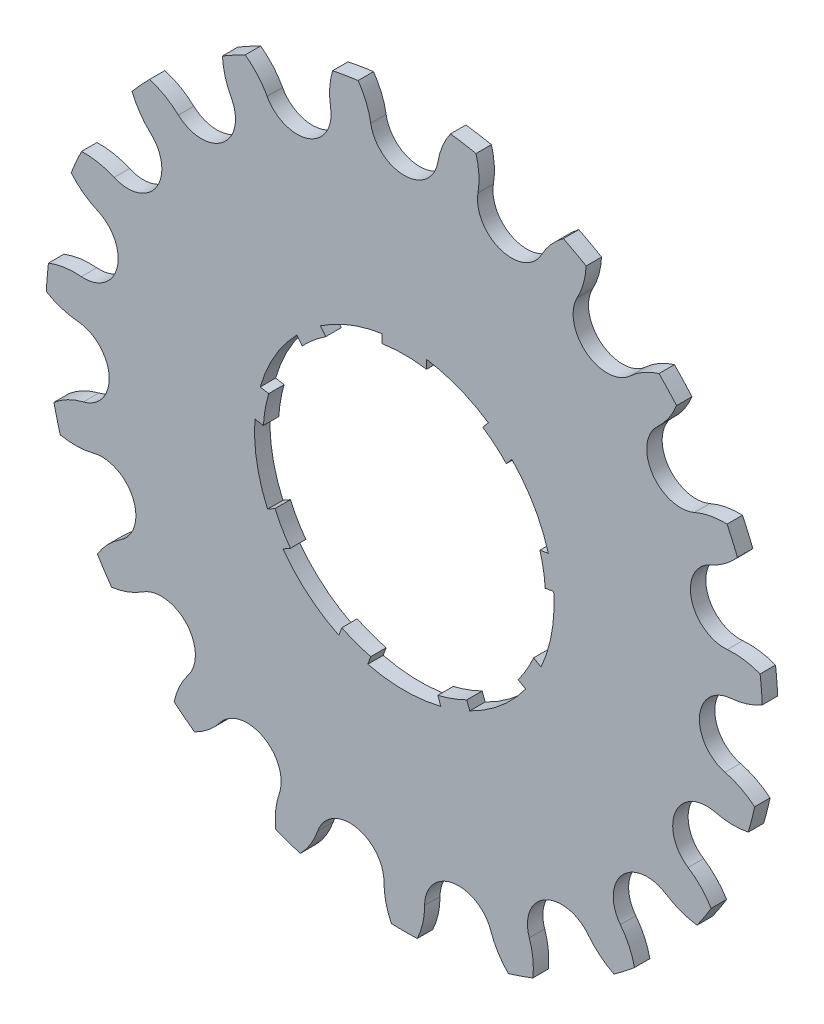
from build123d import *

# Parameters (mm, degrees)
SK_DISCO_R           = 41.863463762
DISCO_DEPTH          = 1.8
HUECO_DIENTE_DEPTH   = 60.231234971
MATRIZ_DIENTES_COUNT = 19


with BuildPart() as part:
    # Sk_Disco → Disco (new body)
    with BuildSketch(Plane.XY):
        Circle(SK_DISCO_R)
        with BuildLine():
            Line((2.6, 17.305779381), (2.6, 16.293863876))
            ThreePointArc((2.6, 16.293863876), (0, 16.5), (-2.6, 16.293863876))
            Line((-2.6, 16.293863876), (-2.6, 17.305779381))
            ThreePointArc((-2.6, 17.305779381), (-6.362648192, 16.302352836), (-9.810241185, 14.491693065))
            Line((-9.810241185, 14.491693065), (-9.163816615, 13.721314261))
            ThreePointArc((-9.163816615, 13.721314261), (-10.60599556, 12.639733311), (-11.92157661, 11.407278866))
            Line((-11.92157661, 11.407278866), (-12.56800118, 12.17765767))
            ThreePointArc((-12.56800118, 12.17765767), (-15.155444566, 8.75), (-16.830161491, 4.795379462))
            Line((-16.830161491, 4.795379462), (-15.839781591, 4.620748764))
            ThreePointArc((-15.839781591, 4.620748764), (-16.249327925, 2.865194932), (-16.464915031, 1.075440854))
            Line((-16.464915031, 1.075440854), (-17.455294931, 1.250071551))
            ThreePointArc((-17.455294931, 1.250071551), (-17.234135678, -3.038843109), (-15.975062189, -7.144745486))
            Line((-15.975062189, -7.144745486), (-15.104136721, -6.641916433))
            ThreePointArc((-15.104136721, -6.641916433), (-14.289419162, -8.25), (-13.304136721, -9.759607887))
            Line((-13.304136721, -9.759607887), (-14.175062189, -10.26243694))
            ThreePointArc((-14.175062189, -10.26243694), (-11.24878317, -13.405777755), (-7.645053746, -15.741764616))
            Line((-7.645053746, -15.741764616), (-7.301098416, -14.796755115))
            ThreePointArc((-7.301098416, -14.796755115), (-5.643332365, -15.504928243), (-3.918204981, -16.028027631))
            Line((-3.918204981, -16.028027631), (-4.262160311, -16.973037132))
            ThreePointArc((-4.262160311, -16.973037132), (0, -17.5), (4.262160311, -16.973037132))
            Line((4.262160311, -16.973037132), (3.918204981, -16.028027631))
            ThreePointArc((3.918204981, -16.028027631), (5.643332365, -15.504928243), (7.301098416, -14.796755115))
            Line((7.301098416, -14.796755115), (7.645053746, -15.741764616))
            ThreePointArc((7.645053746, -15.741764616), (11.24878317, -13.405777755), (14.175062189, -10.26243694))
            Line((14.175062189, -10.26243694), (13.304136721, -9.759607887))
            ThreePointArc((13.304136721, -9.759607887), (14.289419162, -8.25), (15.104136721, -6.641916433))
            Line((15.104136721, -6.641916433), (15.975062189, -7.144745486))
            ThreePointArc((15.975062189, -7.144745486), (17.234135678, -3.038843109), (17.455294931, 1.250071551))
            Line((17.455294931, 1.250071551), (16.464915031, 1.075440854))
            ThreePointArc((16.464915031, 1.075440854), (16.249327925, 2.865194932), (15.839781591, 4.620748764))
            Line((15.839781591, 4.620748764), (16.830161491, 4.795379462))
            ThreePointArc((16.830161491, 4.795379462), (15.155444566, 8.75), (12.56800118, 12.17765767))
            Line((12.56800118, 12.17765767), (11.92157661, 11.407278866))
            ThreePointArc((11.92157661, 11.407278866), (10.60599556, 12.639733311), (9.163816615, 13.721314261))
            Line((9.163816615, 13.721314261), (9.810241185, 14.491693065))
            ThreePointArc((9.810241185, 14.491693065), (6.362648192, 16.302352836), (2.6, 17.305779381))
        make_face(mode=Mode.SUBTRACT)
    extrude(amount=DISCO_DEPTH)

    # Sk_Hueco → Hueco_diente (cut, through all)
    with BuildSketch(Plane.XY):
        with BuildLine():
            ThreePointArc((-3.920786181, 37.925376267), (0, 34.604639763), (3.920786181, 37.925376267))
            ThreePointArc((3.920786181, 37.925376267), (4.997369129, 40.897629213), (7.062369391, 43.291181455))
            ThreePointArc((7.062369391, 43.291181455), (0, 43.863463762), (-7.062369391, 43.291181455))
            ThreePointArc((-7.062369391, 43.291181455), (-4.997369129, 40.897629213), (-3.920786181, 37.925376267))
        make_face()
    hueco_diente = extrude(amount=HUECO_DIENTE_DEPTH, mode=Mode.SUBTRACT)

    # Matriz_dientes: Hueco_diente ×19 about axis
    matriz_dientes_axis = Axis((0, 0, -0.09), (0, 0, 1))
    for i in range(1, MATRIZ_DIENTES_COUNT):
        add(hueco_diente.rotate(matriz_dientes_axis, i * 360 / MATRIZ_DIENTES_COUNT), mode=Mode.SUBTRACT)


solid = part.part
